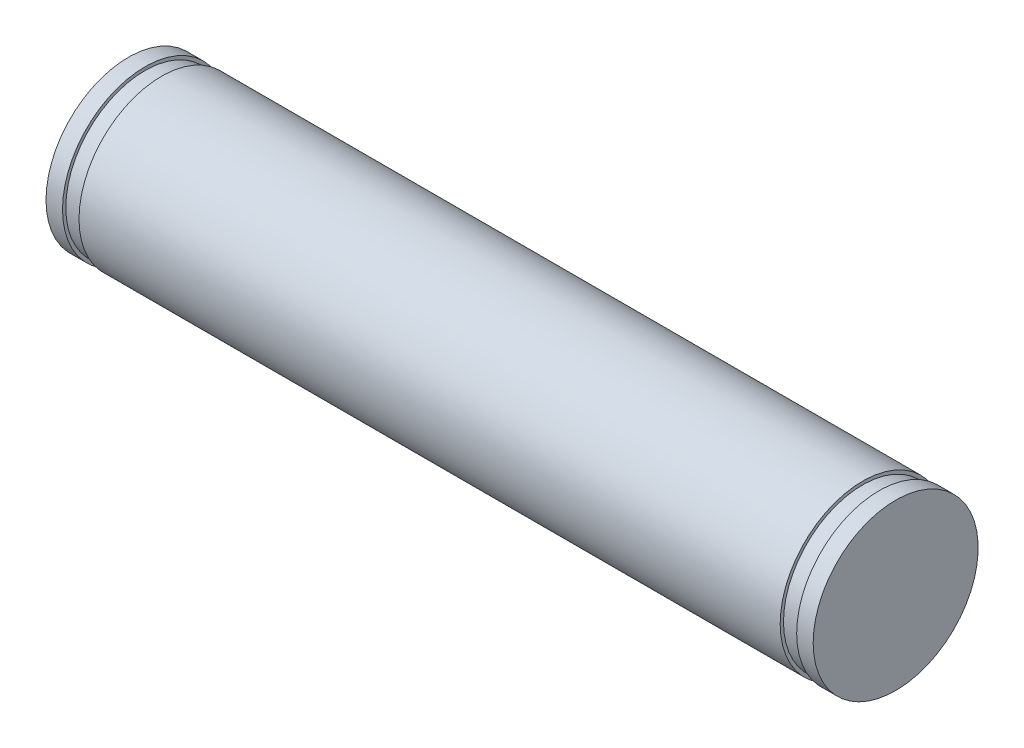
from build123d import *


with BuildPart() as part:
    # Esboço1 → Revolução1 (revolve)
    with BuildSketch(Plane(origin=(0, 0, 0), x_dir=(1, 0, 0), z_dir=(0, 1, 0)), mode=Mode.PRIVATE) as revolu_o1_sk:
        Polygon((-23.25, 0), (-23.25, 5), (-22.25, 5), (-22.25, 4.8), (-21.25, 4.8), (-21.25, 5), (21.25, 5), (21.25, 4.8), (22.25, 4.8), (22.25, 5), (23.25, 5), (23.25, 0), align=None)
    revolve(revolu_o1_sk.sketch.rotate(Axis((-23.25, 0, 0), (1, 0, 0)), 180), axis=Axis((-23.25, 0, 0), (1, 0, 0)))


solid = part.part
